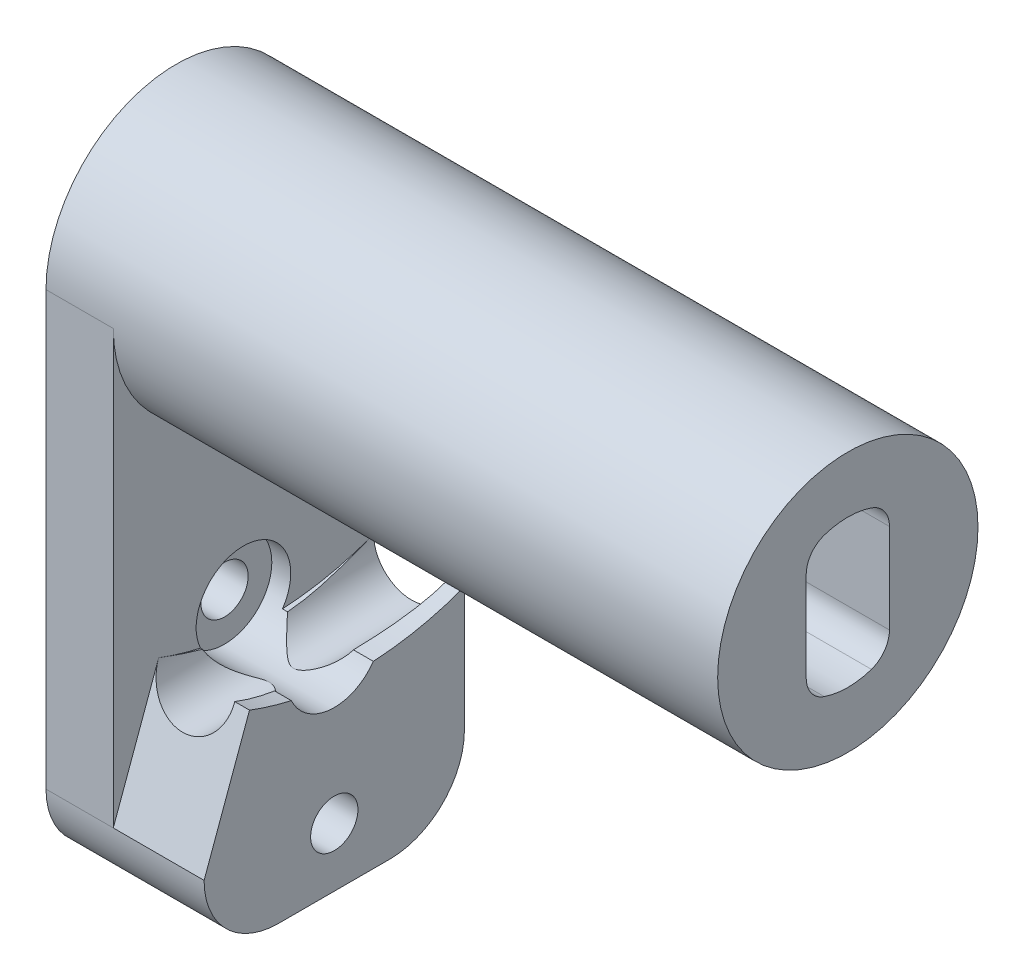
from build123d import *

# Parameters (mm, degrees)
SKETCH1_R           = 8.7376
BOSS_EXTRUDE1_DEPTH = 45.085
BOSS_EXTRUDE3_DEPTH = 4.516000112
FILLET2_R           = 5
BOSS_EXTRUDE4_START = 6.096
BOSS_EXTRUDE4_DEPTH = 6.096
CUT_EXTRUDE8_DEPTH  = 6.096
CUT_EXTRUDE10_DEPTH = 12.192
SKETCH23_R          = 1.5875
CUT_EXTRUDE11_DEPTH = 58.161632016
SKETCH24_R          = 3.175
SKETCH24_R_2        = 1.5875
CUT_EXTRUDE12_DEPTH = 54.671581882
CUT_EXTRUDE13_START = -1.27
SKETCH24_2_R        = 3.175
SKETCH24_2_R_2      = 1.5875
CUT_EXTRUDE13_DEPTH = 1.27
FILLET11_R          = 1.778
SKETCH25_R          = 2.5527
CUT_EXTRUDE14_DEPTH = 60.13111817


with BuildPart() as part:
    # Sketch1 → Boss-Extrude1 (new body)
    with BuildSketch(Plane.YZ):
        with Locations(Location((0, 0, 0), (0, 0, 270))):
            Circle(SKETCH1_R)
    extrude(amount=BOSS_EXTRUDE1_DEPTH)

    # Sketch10 → Boss-Extrude3 (add)
    with BuildSketch(Plane(origin=(0, 0, 0), x_dir=(0, -1, 0), z_dir=(-1, 0, 0))):
        with BuildLine():
            Line((0, 8.7376), (34.036, 8.7376))
            Line((34.036, 8.7376), (34.036, -8.7376))
            Line((34.036, -8.7376), (0, -8.7376))
            ThreePointArc((0, -8.7376), (8.7376, 0), (0, 8.7376))
        make_face()
    extrude(amount=-BOSS_EXTRUDE3_DEPTH)

    # Fillet2
    fillet2_edges = [part.edges().sort_by_distance(p)[0] for p in [
        (2.258000056, -34.036, 8.7376),
        (2.258000056, -34.036, -8.7376),
    ]]
    fillet(fillet2_edges, radius=FILLET2_R)

    # Sketch15 → Boss-Extrude4 (add)
    with BuildSketch(Plane.YZ.offset(4.516000112).offset(BOSS_EXTRUDE4_START)):
        with BuildLine():
            Line((-20.066, 5.472786999), (-29.036, 8.7376))
            ThreePointArc((-29.036, 8.7376), (-32.571533906, 7.273133906), (-34.036, 3.7376))
            Line((-34.036, 3.7376), (-34.036, -3.7376))
            ThreePointArc((-34.036, -3.7376), (-32.571533906, -7.273133906), (-29.036, -8.7376))
            Line((-29.036, -8.7376), (-20.066, -8.7376))
            Line((-20.066, -8.7376), (-20.066, 5.472786999))
        make_face()
    extrude(amount=-BOSS_EXTRUDE4_DEPTH)

    # Sketch21 → Cut-Extrude8 (cut)
    with BuildSketch(Plane.YZ.offset(10.612000112)):
        with BuildLine():
            Line((-20.701, -8.7376), (-20.066, -8.7376))
            Line((-20.066, -8.7376), (-20.066, 5.472786999))
            Line((-20.066, 5.472786999), (-20.662704814, 5.68996979))
            ThreePointArc((-20.662704814, 5.68996979), (-22.005444378, -1.520301887), (-20.701, -8.7376))
        make_face()
    extrude(amount=-CUT_EXTRUDE8_DEPTH, mode=Mode.SUBTRACT)

    # Sketch22 → Cut-Extrude10 (cut)
    with BuildSketch(Plane.YZ.offset(45.085)):
        with BuildLine():
            Line((-4.089715516, -2.794), (4.089715516, -2.794))
            ThreePointArc((4.089715516, -2.794), (4.953, 0), (4.089715516, 2.794))
            Line((4.089715516, 2.794), (-4.089715516, 2.794))
            ThreePointArc((-4.089715516, 2.794), (-4.953, 0), (-4.089715516, -2.794))
        make_face()
    extrude(amount=-CUT_EXTRUDE10_DEPTH, mode=Mode.SUBTRACT)

    # Sketch23 → Cut-Extrude11 (cut, through all)
    with BuildSketch(Plane.ZY):
        with Locations((0, -30.089710358)):
            Circle(SKETCH23_R)
        with Locations((0, -20.184348406)):
            Circle(SKETCH23_R)
    extrude(amount=-CUT_EXTRUDE11_DEPTH, mode=Mode.SUBTRACT)

    # Sketch24 → Cut-Extrude12 (cut, through all)
    with BuildSketch(Plane.YZ.offset(4.516000112)):
        with Locations((-20.184348406, 0)):
            Circle(SKETCH24_R)
        with Locations(Location((-20.184348406, 0, 0), (0, 0, 90))):
            Circle(SKETCH24_R_2, mode=Mode.SUBTRACT)
    extrude(amount=CUT_EXTRUDE12_DEPTH, mode=Mode.SUBTRACT)

    # Sketch24<2> → Cut-Extrude13 (cut)
    with BuildSketch(Plane.YZ.offset(4.516000112).offset(CUT_EXTRUDE13_START)):
        with Locations(Location((-20.184348406, 0, 0), (0, 0, 114.682734544))):
            Circle(SKETCH24_2_R)
        with Locations(Location((-20.184348406, 0, 0), (0, 0, 90))):
            Circle(SKETCH24_2_R_2, mode=Mode.SUBTRACT)
    extrude(amount=CUT_EXTRUDE13_DEPTH, mode=Mode.SUBTRACT)

    # Fillet11
    fillet11_edges = [part.edges().sort_by_distance(p)[0] for p in [
        (38.989, 4.089715516, 2.794),
        (38.989, 4.089715516, -2.794),
        (38.989, -4.089715516, -2.794),
        (38.989, -4.089715516, 2.794),
    ]]
    fillet(fillet11_edges, radius=FILLET11_R)

    # Sketch25 → Cut-Extrude14 (cut, through all)
    with BuildSketch(Plane(origin=(0, 0, -8.7376), x_dir=(1, 0, 0), z_dir=(0, 0, -1))):
        with Locations((7.068700112, 20.701)):
            Circle(SKETCH25_R)
    extrude(amount=-CUT_EXTRUDE14_DEPTH, mode=Mode.SUBTRACT)


solid = part.part
